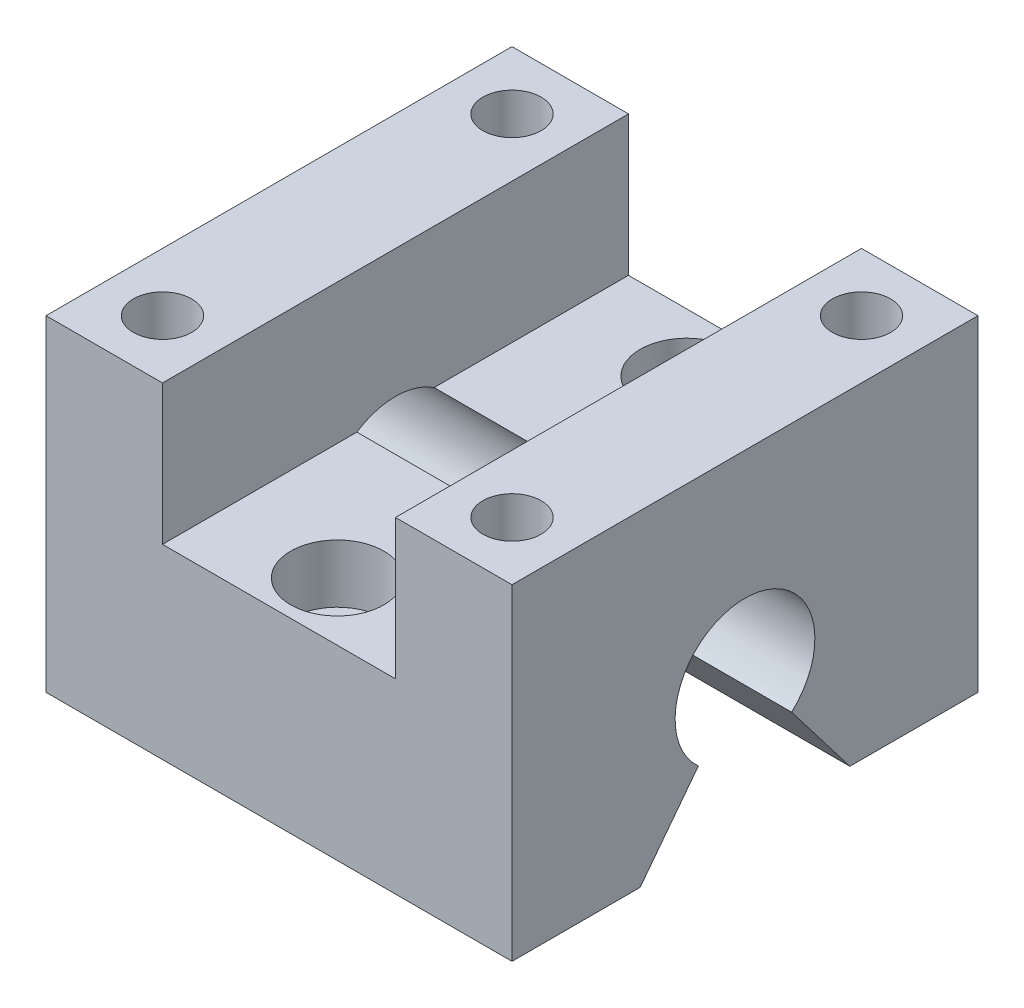
from build123d import *

# Parameters (mm, degrees)
EXTRUDE_1_DEPTH          = 20
CUT_EXTRUDE_1_DEPTH      = 32.559467676
CUT_EXTRUDE_1_DEPTH_BACK = 32.559467676
SKETCH_2_W               = 20
SKETCH_2_H               = 19.616393828
SKETCH_3_R               = 4
CUT_EXTRUDE_2_DEPTH      = 5
SKETCH_4_R               = 2.5
CUT_EXTRUDE_3_DEPTH      = 10


with BuildPart() as part:
    # Эскиз1 → Бобышка-Вытянуть1 (new, symmetric)
    with BuildSketch(Plane(origin=(0, 0, 0), x_dir=(0, 0, -1), z_dir=(1, 0, 0))):
        with BuildLine():
            Line((-4, -7.472135955), (-9, -14))
            Line((-9, -14), (-20, -14))
            Line((-20, -14), (-20, 14))
            Line((-20, 14), (20, 14))
            Line((20, 14), (20, -14))
            Line((20, -14), (9, -14))
            Line((9, -14), (4, -7.472135955))
            ThreePointArc((4, -7.472135955), (0, 3), (-4, -7.472135955))
        make_face()
    extrude(amount=EXTRUDE_1_DEPTH, both=True)

    # Эскиз2 → Вырез-Вытянуть1 (cut, two sides: drawn at the far end of the back side and taken through both)
    with BuildSketch(Plane.XY.offset(-CUT_EXTRUDE_1_DEPTH_BACK)):
        with Locations((0, 11.808196914)):
            Rectangle(SKETCH_2_W, SKETCH_2_H)
    extrude(amount=CUT_EXTRUDE_1_DEPTH + CUT_EXTRUDE_1_DEPTH_BACK, mode=Mode.SUBTRACT)

    # Эскиз3 → Вырез-Вытянуть2 (cut)
    with BuildSketch(Plane(origin=(0, 2, 0), x_dir=(1, 0, 0), z_dir=(0, 1, 0))):
        with Locations(Location((0, 15, 0), (0, 0, 270))):
            Circle(SKETCH_3_R)
        with Locations(Location((0, -15, 0), (0, 0, 270))):
            Circle(SKETCH_3_R)
    extrude(amount=-CUT_EXTRUDE_2_DEPTH, mode=Mode.SUBTRACT)

    # Эскиз4 → Вырез-Вытянуть3 (cut)
    with BuildSketch(Plane(origin=(0, 14, 0), x_dir=(1, 0, 0), z_dir=(0, 1, 0))):
        with Locations(Location((-15, 15, 0), (0, 0, 270))):
            Circle(SKETCH_4_R)
        with Locations(Location((-15, -15, 0), (0, 0, 270))):
            Circle(SKETCH_4_R)
        with Locations(Location((15, -15, 0), (0, 0, 270))):
            Circle(SKETCH_4_R)
        with Locations(Location((15, 15, 0), (0, 0, 270))):
            Circle(SKETCH_4_R)
    extrude(amount=-CUT_EXTRUDE_3_DEPTH, mode=Mode.SUBTRACT)


solid = part.part
